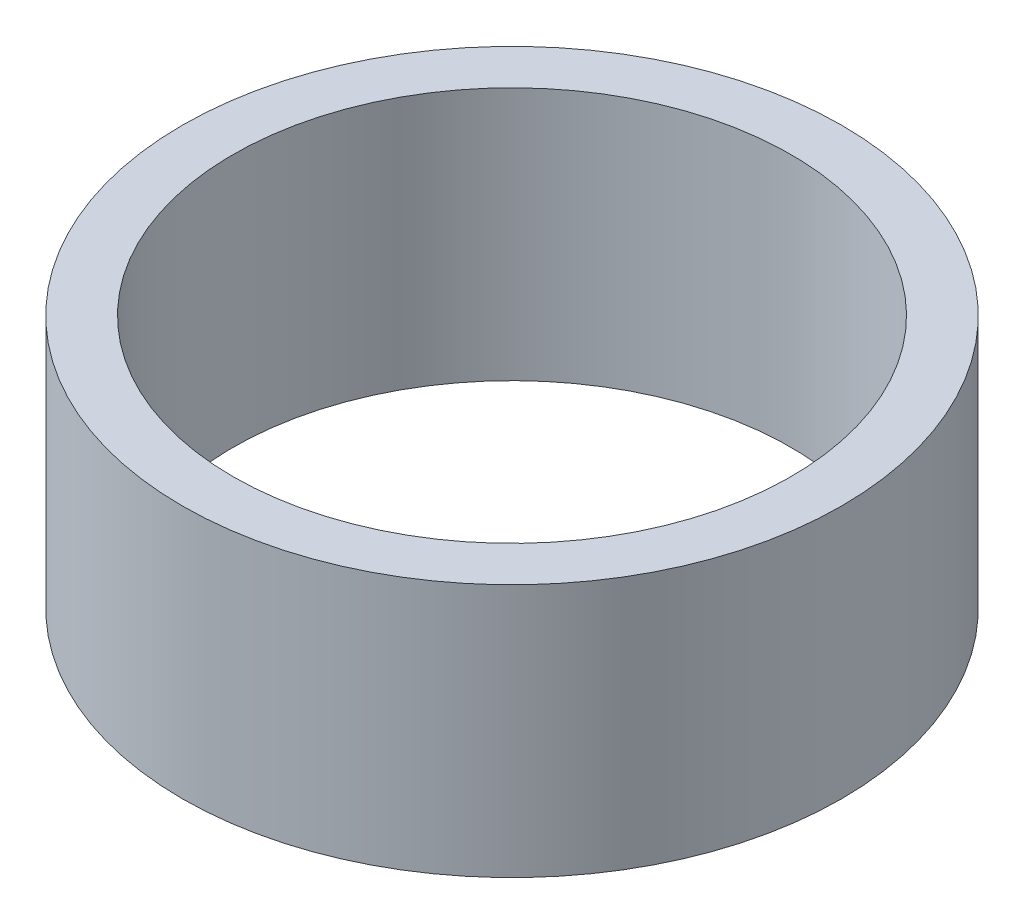
from build123d import *

# Parameters (mm, degrees)
SKETCH1_R           = 6.5
SKETCH1_R_2         = 5.5
BOSS_EXTRUDE1_DEPTH = 5


with BuildPart() as part:
    # Sketch1 → Boss-Extrude1 (new body)
    with BuildSketch(Plane(origin=(0, 0, 0), x_dir=(1, 0, 0), z_dir=(0, 1, 0))):
        with Locations(Location((0, 0, 0), (0, 0, 270))):
            Circle(SKETCH1_R)
        with Locations(Location((0, 0, 0), (0, 0, 270))):
            Circle(SKETCH1_R_2, mode=Mode.SUBTRACT)
    extrude(amount=BOSS_EXTRUDE1_DEPTH)


solid = part.part
